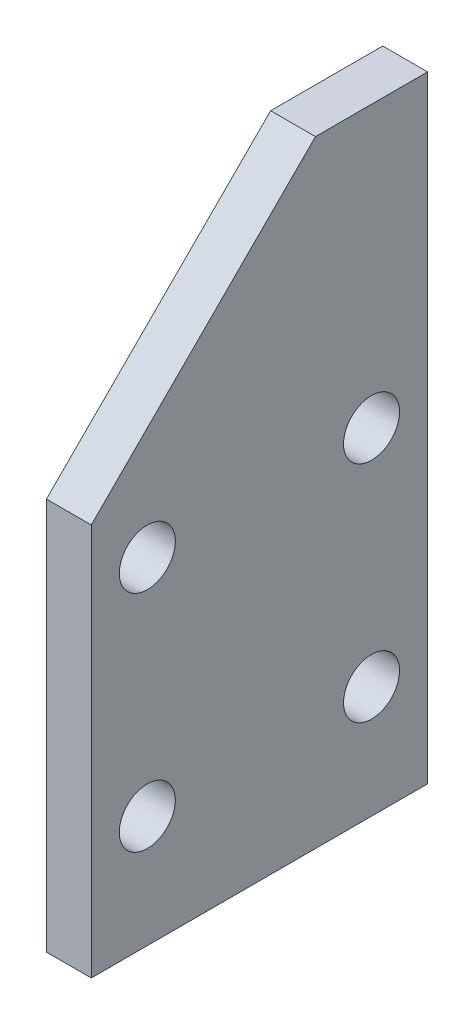
from build123d import *

# Parameters (mm, degrees)
SKETCH_1_R      = 2.5
EXTRUDE_1_DEPTH = 4


with BuildPart() as part:
    # Эскиз1 → Бобышка-Вытянуть1 (new body)
    with BuildSketch(Plane(origin=(0, 0, 0), x_dir=(0, 0, -1), z_dir=(1, 0, 0))):
        Polygon((0, 0), (30, 0), (30, 55), (20, 55), (0, 35), align=None)
        with Locations((5, 10)):
            Circle(SKETCH_1_R, mode=Mode.SUBTRACT)
        with Locations((25, 10)):
            Circle(SKETCH_1_R, mode=Mode.SUBTRACT)
        with Locations((5, 30)):
            Circle(SKETCH_1_R, mode=Mode.SUBTRACT)
        with Locations((25, 30)):
            Circle(SKETCH_1_R, mode=Mode.SUBTRACT)
    extrude(amount=EXTRUDE_1_DEPTH)


solid = part.part
